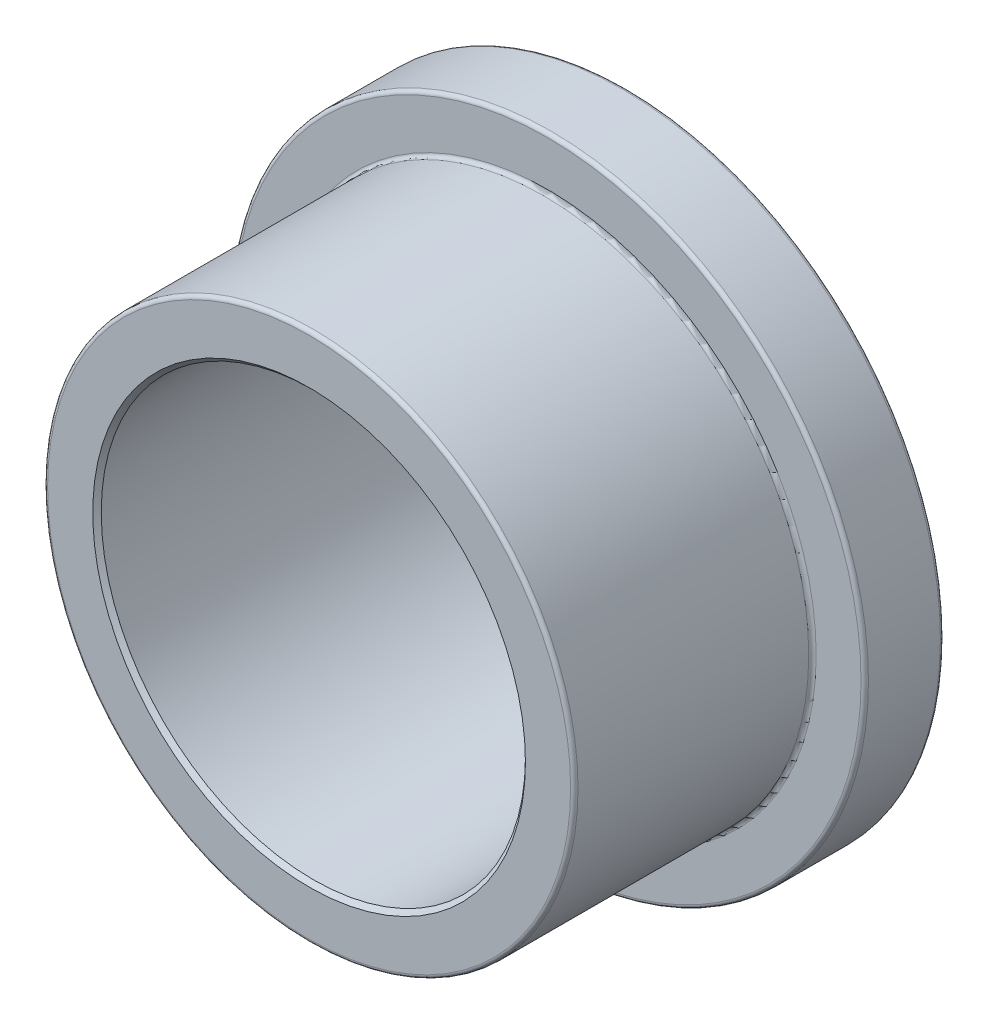
from build123d import *

# Parameters (mm, degrees)
SKETCH3_R           = 15.9131
SKETCH3_R_2         = 12.7254
BOSS_EXTRUDE1_DEPTH = 19.05
SKETCH4_R           = 19.05
SKETCH4_R_2         = 15.9131
BOSS_EXTRUDE2_DEPTH = 4.7625
CHAMFER1_SIZE       = 0.254508
FILLET1_R           = 0.2227834


with BuildPart() as part:
    # Sketch3 → Boss-Extrude1 (new body)
    with BuildSketch(Plane.XY):
        with Locations(Location((0, 0, 0), (0, 0, 180))):
            Circle(SKETCH3_R)
        with Locations(Location((0, 0, 0), (0, 0, 180))):
            Circle(SKETCH3_R_2, mode=Mode.SUBTRACT)
    extrude(amount=BOSS_EXTRUDE1_DEPTH)

    # Sketch4 → Boss-Extrude2 (add)
    with BuildSketch(Plane.XY):
        with Locations(Location((0, 0, 0), (0, 0, 180))):
            Circle(SKETCH4_R)
        with Locations(Location((0, 0, 0), (0, 0, 180))):
            Circle(SKETCH4_R_2, mode=Mode.SUBTRACT)
    extrude(amount=BOSS_EXTRUDE2_DEPTH)

    # Chamfer1
    chamfer1_edges = [part.edges().sort_by_distance(p)[0] for p in [
        (12.7254, 0, 0),
        (12.7254, 0, 19.05),
    ]]
    chamfer(chamfer1_edges, length=CHAMFER1_SIZE)

    # Fillet1
    fillet1_edges = [part.edges().sort_by_distance(p)[0] for p in [
        (19.05, 0, 4.7625),
        (19.05, 0, 0),
        (15.9131, 0, 4.7625),
        (15.9131, 0, 19.05),
    ]]
    fillet(fillet1_edges, radius=FILLET1_R)


solid = part.part
